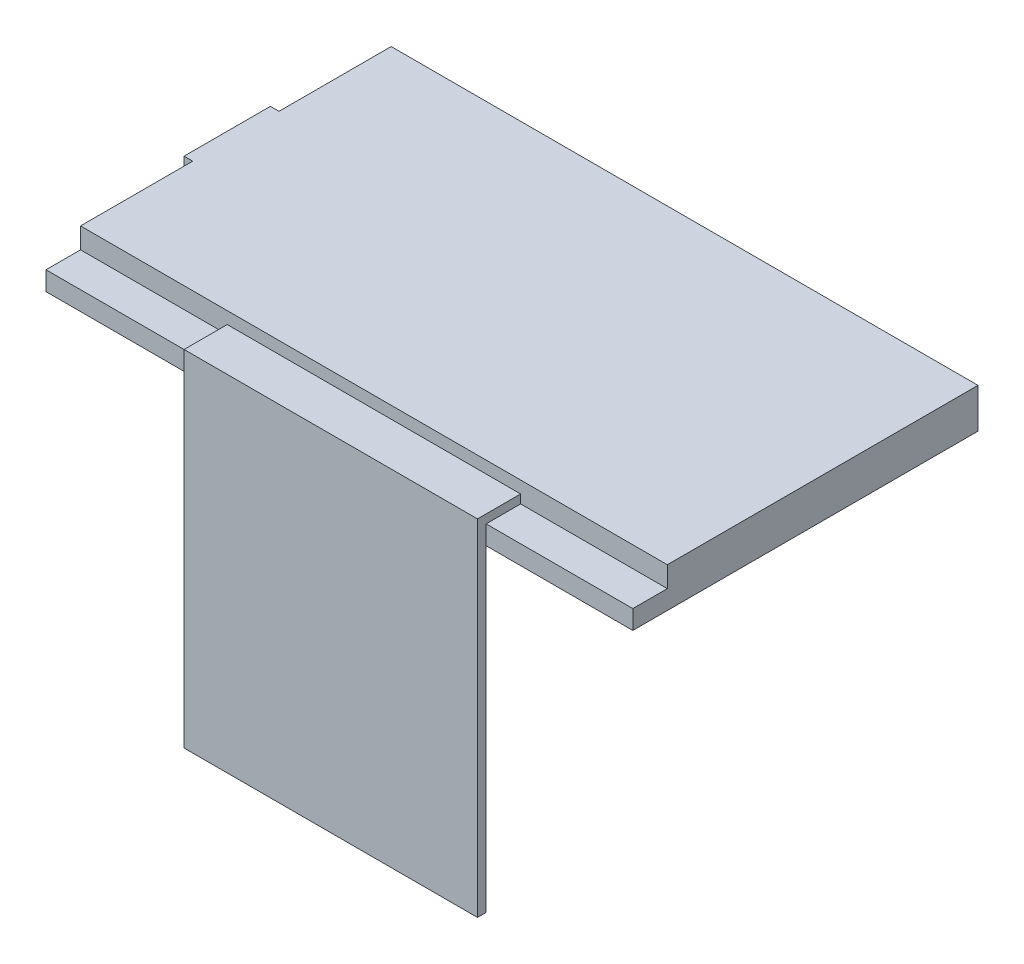
from build123d import *

# Parameters (mm, degrees)
SKETCH1_W           = 34
SKETCH1_H           = 20
BOSS_EXTRUDE1_DEPTH = 1.1
SKETCH3_W           = 34
SKETCH3_H           = 18
BOSS_EXTRUDE2_DEPTH = 1.2
SKETCH4_W           = 5
SKETCH4_H           = 2.3
BOSS_EXTRUDE3_DEPTH = 0.5
SKETCH5_W           = 17
SKETCH5_H           = 2
BOSS_EXTRUDE4_DEPTH = 0.5
SKETCH6_W           = 17
SKETCH6_H           = 0.5
BOSS_EXTRUDE5_DEPTH = 20


with BuildPart() as part:
    # Sketch1 → Boss-Extrude1 (new body)
    with BuildSketch(Plane(origin=(0, 0, 0), x_dir=(1, 0, 0), z_dir=(0, 1, 0))):
        Rectangle(SKETCH1_W, SKETCH1_H)
    extrude(amount=BOSS_EXTRUDE1_DEPTH)

    # Sketch3 → Boss-Extrude2 (add)
    with BuildSketch(Plane(origin=(0, 1.1, 0), x_dir=(1, 0, 0), z_dir=(0, 1, 0))):
        with Locations((0, 1)):
            Rectangle(SKETCH3_W, SKETCH3_H)
    extrude(amount=BOSS_EXTRUDE2_DEPTH)

    # Sketch4 → Boss-Extrude3 (add)
    with BuildSketch(Plane.ZY.offset(17)):
        with Locations((-1, 1.15)):
            Rectangle(SKETCH4_W, SKETCH4_H)
    extrude(amount=BOSS_EXTRUDE3_DEPTH)

    # Sketch5 → Boss-Extrude4 (add)
    with BuildSketch(Plane(origin=(0, 1.1, 0), x_dir=(1, 0, 0), z_dir=(0, 1, 0))):
        with Locations((0, -9)):
            Rectangle(SKETCH5_W, SKETCH5_H)
    extrude(amount=BOSS_EXTRUDE4_DEPTH)

    # Sketch6 → Boss-Extrude5 (add)
    with BuildSketch(Plane(origin=(0, 1.6, 0), x_dir=(1, 0, 0), z_dir=(0, 1, 0))):
        with Locations((0, -10.25)):
            Rectangle(SKETCH6_W, SKETCH6_H)
    extrude(amount=-BOSS_EXTRUDE5_DEPTH)


solid = part.part
